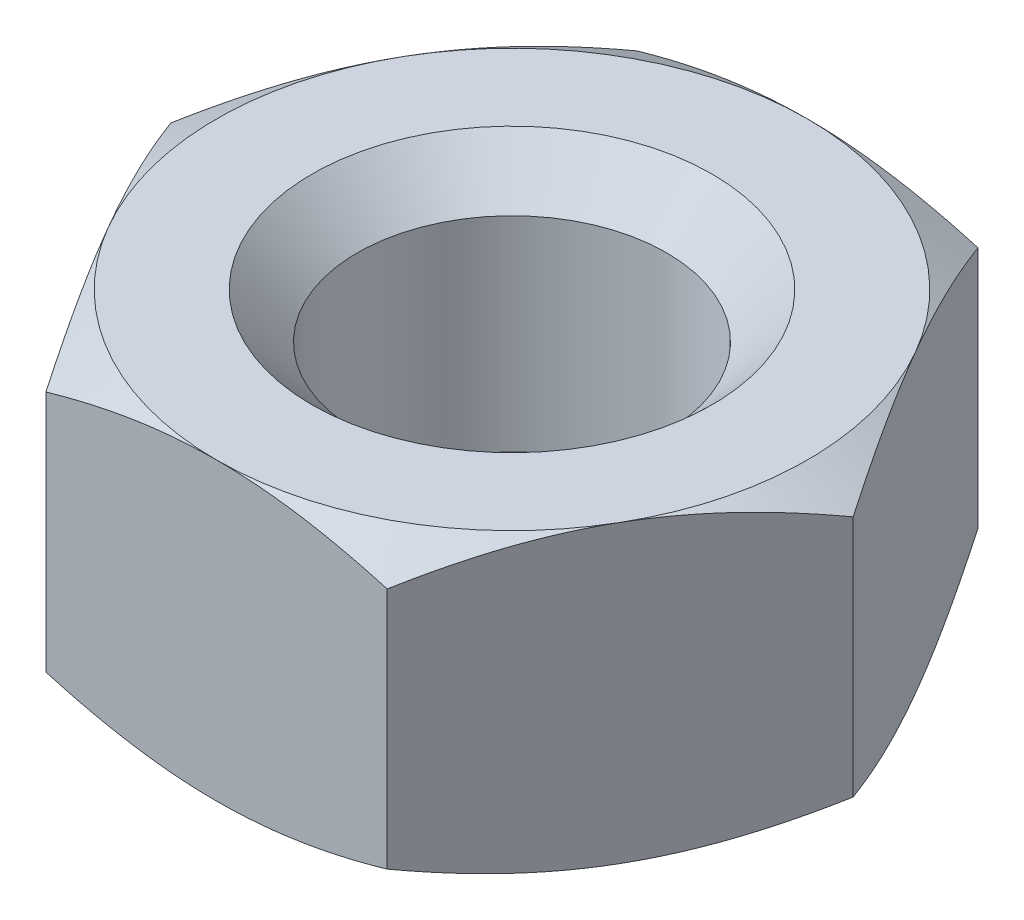
from build123d import *

# Parameters (mm, degrees)
BOSS_EXTRUDE1_DEPTH = 6.5
M8_TAPPED_HOLE1_D   = 6.8
CHAMFER1_SIZE       = 1


with BuildPart() as part:
    # Sketch1 → Boss-Extrude1 (new body)
    with BuildSketch(Plane(origin=(0, 0, 0), x_dir=(1, 0, 0), z_dir=(0, 1, 0))):
        Polygon((3.75277675, 6.5), (-3.75277675, 6.5), (-7.505553499, 0), (-3.75277675, -6.5), (3.75277675, -6.5), (7.505553499, 0), align=None)
    extrude(amount=BOSS_EXTRUDE1_DEPTH)

    # Sketch2 → Cut-Revolve1 (revolve, cut)
    with BuildSketch(Plane(origin=(0, 0, 0), x_dir=(0, 0, -1), z_dir=(1, 0, 0))):
        Polygon((-9.964101615, 6.5), (-9.964101615, 4.5), (-6.5, 6.5), align=None)
        Polygon((-9.964101615, 2), (-6.5, 0), (-9.964101615, 0), align=None)
    revolve(axis=Axis((0, 0, 0), (0, 1, 0)), mode=Mode.SUBTRACT)

    # M8 Tapped Hole1 (through all)
    with Locations(Plane(origin=(0, 6.5, 0), x_dir=(-1, 0, 0), z_dir=(0, 1, 0))):
        with Locations((0, 0)):
            Hole(M8_TAPPED_HOLE1_D / 2)

    # Chamfer1
    chamfer1_edges = [part.edges().sort_by_distance(p)[0] for p in [
        (-3.4, 6.5, 0),
        (-3.4, 0, 0),
    ]]
    chamfer(chamfer1_edges, length=CHAMFER1_SIZE)


solid = part.part
